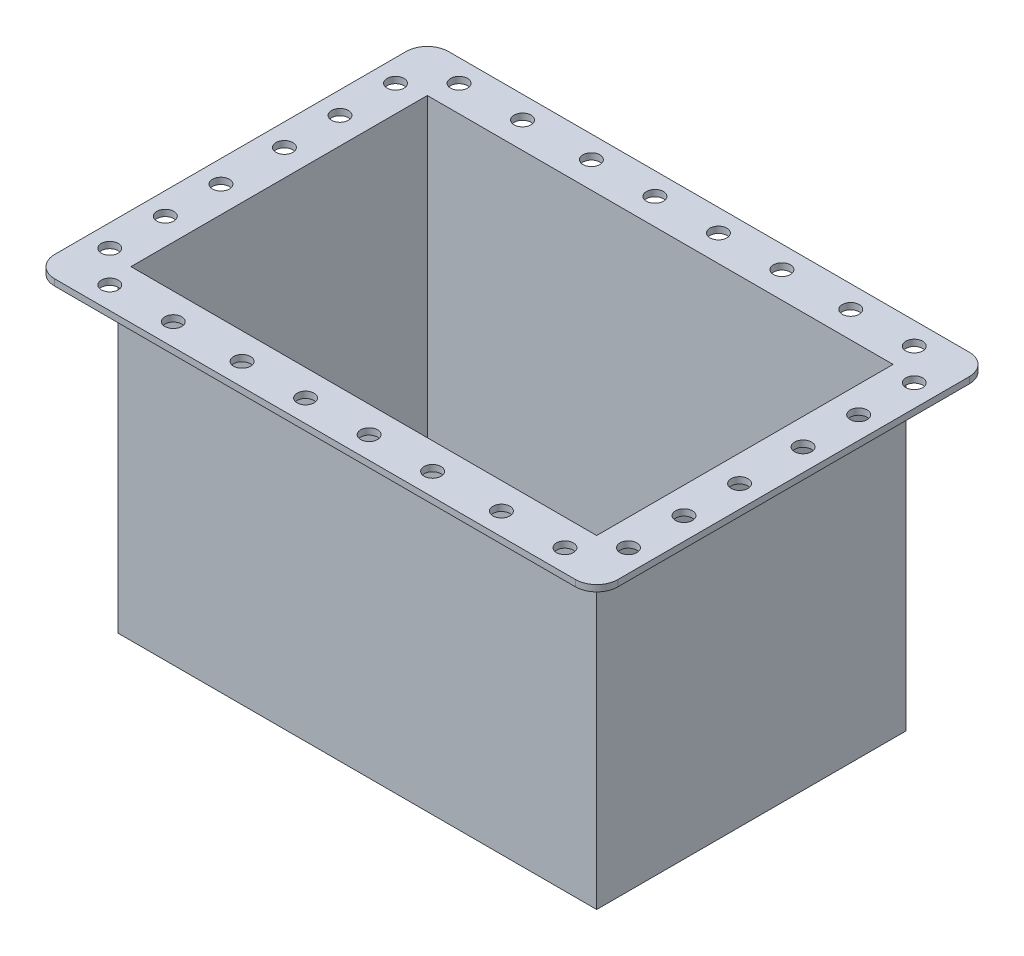
from build123d import *

# Parameters (mm, degrees)
SKETCH1_W           = 226
SKETCH1_H           = 146
SKETCH1_W_2         = 220
SKETCH1_H_2         = 140
BOSS_EXTRUDE1_DEPTH = 150
SKETCH1_4_W         = 220
SKETCH1_4_H         = 140
BOSS_EXTRUDE2_DEPTH = 3
SKETCH2_W           = 266
SKETCH2_H           = 186
SKETCH2_W_2         = 220
SKETCH2_H_2         = 140
BOSS_EXTRUDE3_DEPTH = 3
FILLET1_R           = 10
SKETCH3_R           = 4
CUT_EXTRUDE1_DEPTH  = 221.993212565


with BuildPart() as part:
    # Sketch1 → Boss-Extrude1 (new body)
    with BuildSketch(Plane(origin=(0, 0, 0), x_dir=(1, 0, 0), z_dir=(0, 1, 0))):
        Rectangle(SKETCH1_W, SKETCH1_H)
        Rectangle(SKETCH1_W_2, SKETCH1_H_2, mode=Mode.SUBTRACT)
    extrude(amount=BOSS_EXTRUDE1_DEPTH)

    # Sketch1<4> → Boss-Extrude2 (add)
    with BuildSketch(Plane(origin=(0, 0, 0), x_dir=(1, 0, 0), z_dir=(0, 1, 0))):
        Rectangle(SKETCH1_4_W, SKETCH1_4_H)
    extrude(amount=BOSS_EXTRUDE2_DEPTH)

    # Sketch2 → Boss-Extrude3 (add)
    with BuildSketch(Plane(origin=(0, 150, 0), x_dir=(1, 0, 0), z_dir=(0, 1, 0))):
        Rectangle(SKETCH2_W, SKETCH2_H)
        Rectangle(SKETCH2_W_2, SKETCH2_H_2, mode=Mode.SUBTRACT)
    extrude(amount=-BOSS_EXTRUDE3_DEPTH)

    # Fillet1
    fillet1_edges = [part.edges().sort_by_distance(p)[0] for p in [
        (133, 148.5, -93),
        (-133, 148.5, -93),
        (133, 148.5, 93),
        (-133, 148.5, 93),
    ]]
    fillet(fillet1_edges, radius=FILLET1_R)

    # Sketch3 → Cut-Extrude1 (cut, through all)
    with BuildSketch(Plane(origin=(0, 150, 0), x_dir=(1, 0, 0), z_dir=(0, 1, 0))):
        with Locations((-122.5, -15)):
            Circle(SKETCH3_R)
        with Locations((-122.5, -41.25)):
            Circle(SKETCH3_R)
        with Locations((-122.5, -67.5)):
            Circle(SKETCH3_R)
        with Locations((-107.5, -82.5)):
            Circle(SKETCH3_R)
        with Locations((-77.5, -82.5)):
            Circle(SKETCH3_R)
        with Locations((-45, -82.5)):
            Circle(SKETCH3_R)
        with Locations((-15, -82.5)):
            Circle(SKETCH3_R)
        with Locations((-45, 82.5)):
            Circle(SKETCH3_R)
        with Locations((-15, 82.5)):
            Circle(SKETCH3_R)
        with Locations((-77.5, 82.5)):
            Circle(SKETCH3_R)
        with Locations((-107.5, 82.5)):
            Circle(SKETCH3_R)
        with Locations((-122.5, 67.5)):
            Circle(SKETCH3_R)
        with Locations((-122.5, 41.25)):
            Circle(SKETCH3_R)
        with Locations((-122.5, 15)):
            Circle(SKETCH3_R)
        with Locations((15, -82.5)):
            Circle(SKETCH3_R)
        with Locations((45, -82.5)):
            Circle(SKETCH3_R)
        with Locations((107.5, -82.5)):
            Circle(SKETCH3_R)
        with Locations((122.5, -67.5)):
            Circle(SKETCH3_R)
        with Locations((122.5, -41.25)):
            Circle(SKETCH3_R)
        with Locations((122.5, -15)):
            Circle(SKETCH3_R)
        with Locations((122.5, 15)):
            Circle(SKETCH3_R)
        with Locations((122.5, 41.25)):
            Circle(SKETCH3_R)
        with Locations((122.5, 67.5)):
            Circle(SKETCH3_R)
        with Locations((107.5, 82.5)):
            Circle(SKETCH3_R)
        with Locations((77.5, 82.5)):
            Circle(SKETCH3_R)
        with Locations((45, 82.5)):
            Circle(SKETCH3_R)
        with Locations((15, 82.5)):
            Circle(SKETCH3_R)
        with Locations((77.5, -82.5)):
            Circle(SKETCH3_R)
    extrude(amount=-CUT_EXTRUDE1_DEPTH, mode=Mode.SUBTRACT)


solid = part.part
